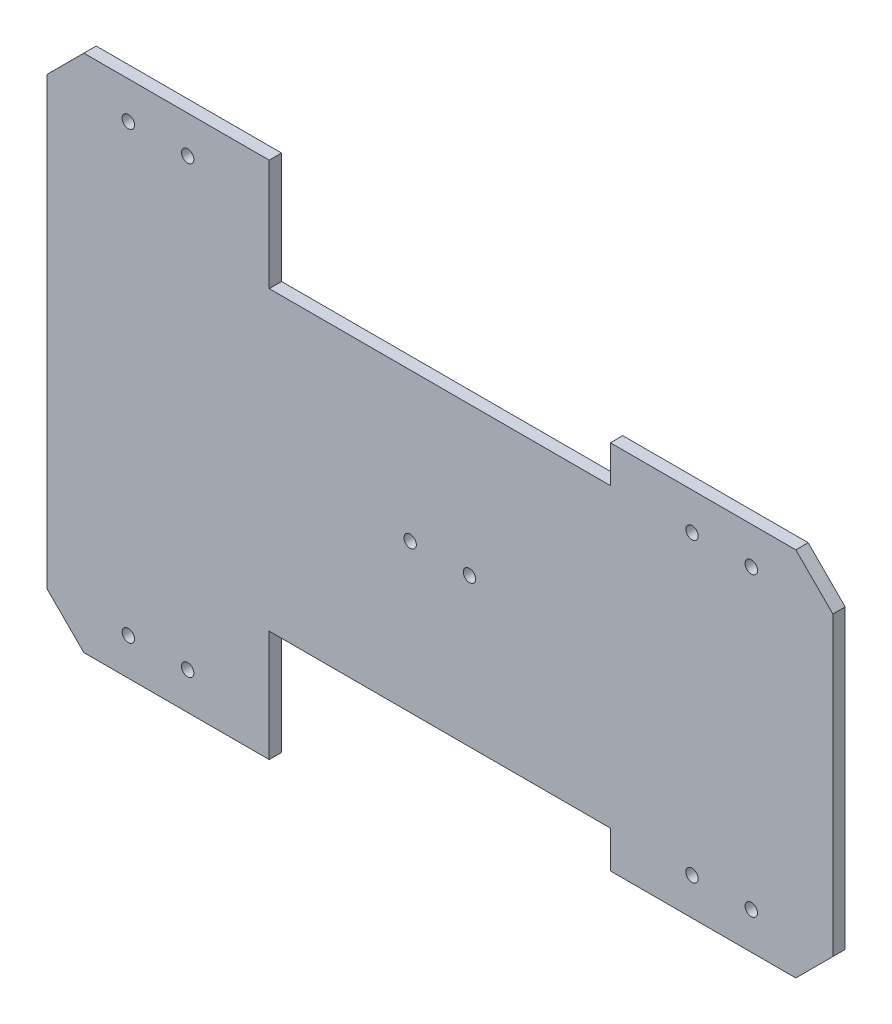
from build123d import *

# Parameters (mm, degrees)
SKETCH_1_R      = 2.5
EXTRUDE_1_DEPTH = 5


with BuildPart() as part:
    # 草图1 → 凸台-拉伸1 (new body)
    with BuildSketch(Plane.XY.offset(5)):
        Polygon((15.930030419, -70.000000012), (15.930030419, -84.99999999), (90.930030476, -84.99999999), (105.930030424, -70.000000041), (105.930030424, 50.000000019), (90.930030476, 64.999999967), (15.930030419, 64.999999967), (15.930030419, 50.000000018), (-122.069969569, 50.000000018), (-122.069969569, 94.999999997), (-197.069969626, 94.999999997), (-212.069969578, 80.000000045), (-212.069969578, -100.000000045), (-197.069969626, -114.999999997), (-122.069969569, -114.999999997), (-122.069969569, -70.000000012), align=None)
        with Locations((-179.069969574, 80)):
            Circle(SKETCH_1_R, mode=Mode.SUBTRACT)
        with Locations(Location((-179.069969574, -100, 0), (0, 0, 180))):
            Circle(SKETCH_1_R, mode=Mode.SUBTRACT)
        with Locations(Location((72.930030422, -70.000000022, 0), (0, 0, 180))):
            Circle(SKETCH_1_R, mode=Mode.SUBTRACT)
        with Locations(Location((48.930030422, 50, 0), (0, 0, 180))):
            Circle(SKETCH_1_R, mode=Mode.SUBTRACT)
        with Locations(Location((-155.069969574, 80, 0), (0, 0, 180))):
            Circle(SKETCH_1_R, mode=Mode.SUBTRACT)
        with Locations((-155.069969574, -100)):
            Circle(SKETCH_1_R, mode=Mode.SUBTRACT)
        with Locations(Location((-65.069969575, -10, 0), (0, 0, 180))):
            Circle(SKETCH_1_R, mode=Mode.SUBTRACT)
        with Locations(Location((-41.069969575, -10.000000011, 0), (0, 0, 180))):
            Circle(SKETCH_1_R, mode=Mode.SUBTRACT)
        with Locations((72.930030422, 50)):
            Circle(SKETCH_1_R, mode=Mode.SUBTRACT)
        with Locations((48.930030422, -70.000000022)):
            Circle(SKETCH_1_R, mode=Mode.SUBTRACT)
    extrude(amount=-EXTRUDE_1_DEPTH)


solid = part.part
